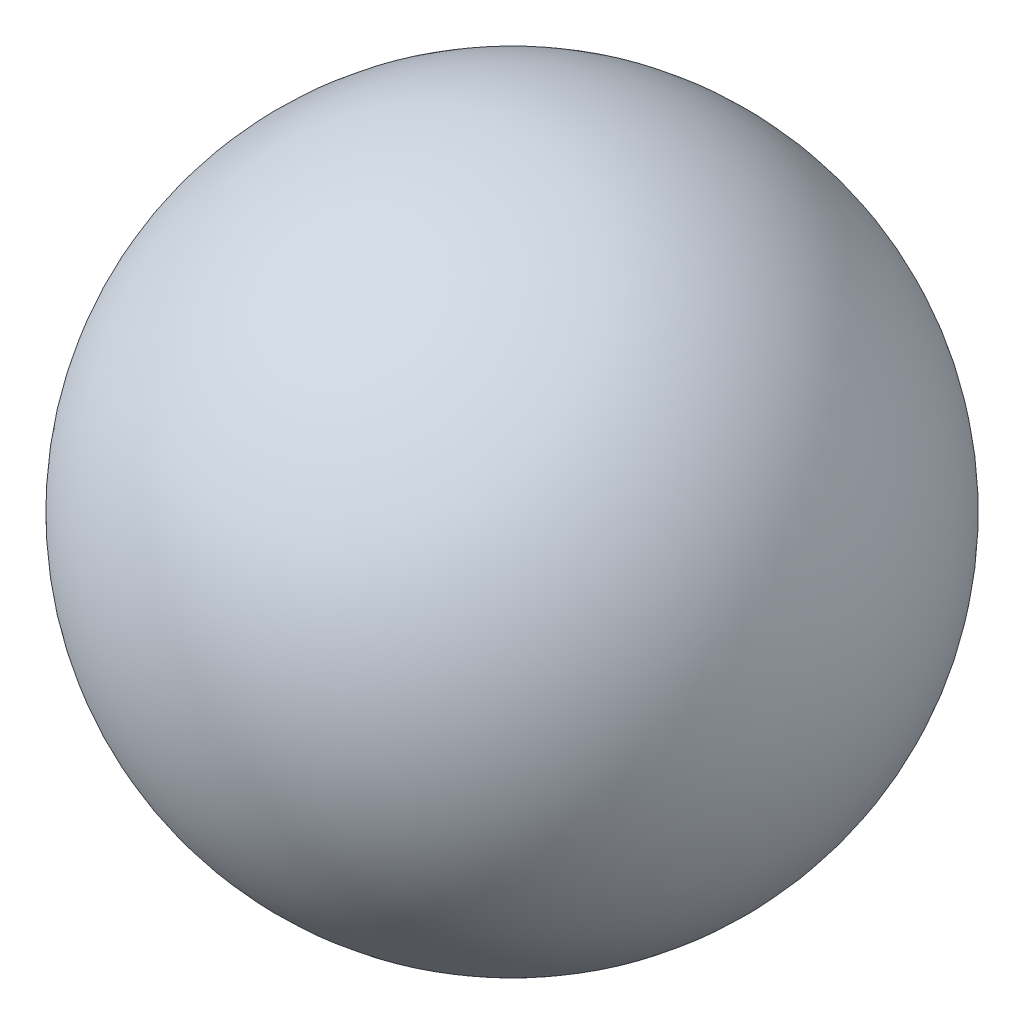
from build123d import *


with BuildPart() as part:
    # Sketch1 → Revolve1 (revolve)
    with BuildSketch(Plane.XY):
        with BuildLine():
            Line((0, 763.39), (0, 760))
            ThreePointArc((0, 760), (-760, 0), (0, -760))
            Line((0, -760), (0, -763.39))
            ThreePointArc((0, -763.39), (-763.39, 0), (0, 763.39))
        make_face()
    revolve(axis=Axis((0, -760, 0), (0, -1, 0)))


solid = part.part
